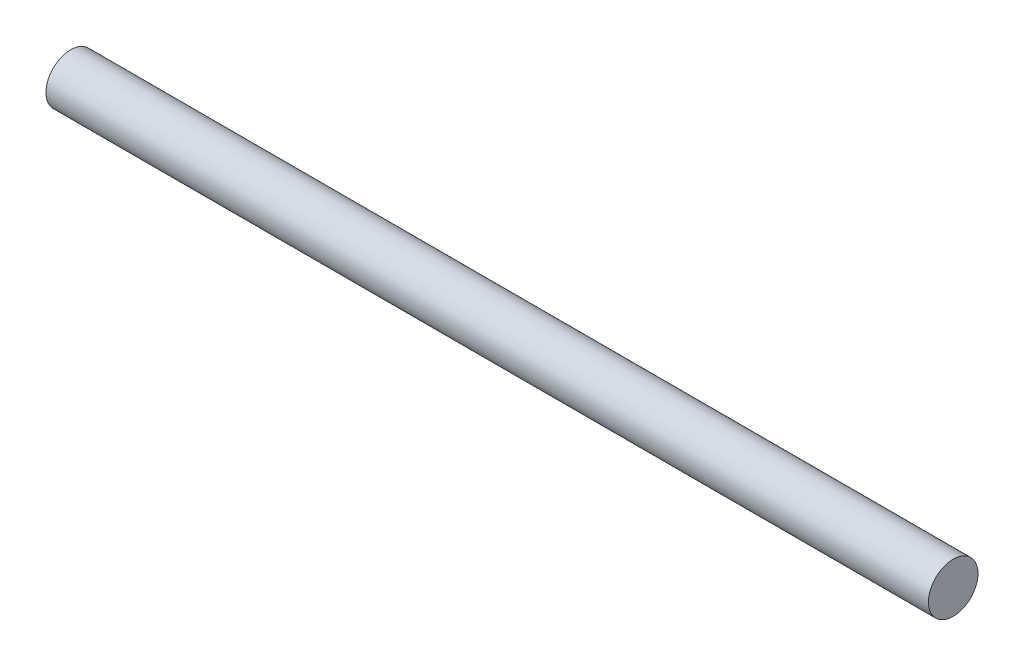
from build123d import *


with BuildPart() as part:
    # Sketch1 → Revolve1 (revolve)
    with BuildSketch(Plane.XY, mode=Mode.PRIVATE) as revolve1_sk:
        Polygon((127, 7.5), (-140, 7.5), (-140, 5.5), (-127, 5.5), (-127, 0), (127, 0), align=None)
    revolve(revolve1_sk.sketch.rotate(Axis((196.356223274, 0, 0), (-1, 0, 0)), 90), axis=Axis((196.356223274, 0, 0), (-1, 0, 0)))


solid = part.part
